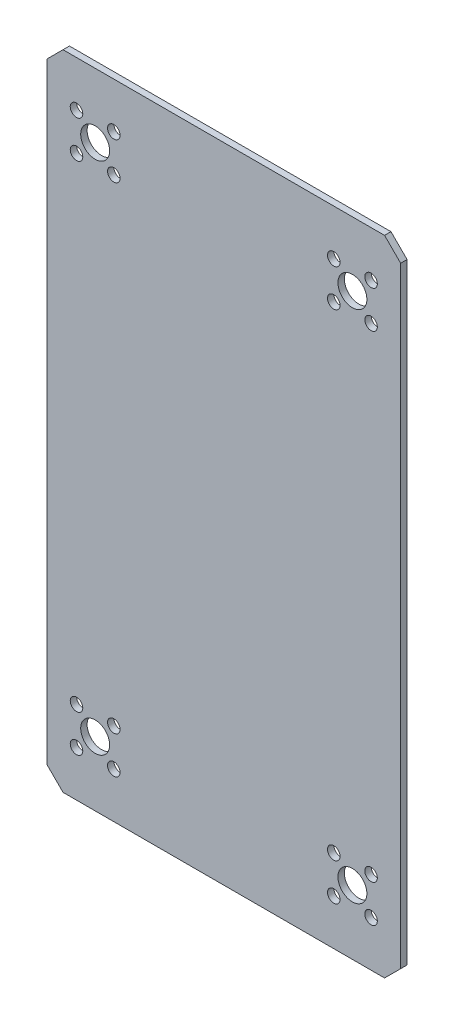
from build123d import *

# Parameters (mm, degrees)
SKETCH1_W           = 110
SKETCH1_H           = 200
BOSS_EXTRUDE1_DEPTH = 2
SKETCH6_R           = 4.5
SKETCH6_R_2         = 1.95
LEANDUT_HOLES_DEPTH = 115.144645078
CHAMFER1_SIZE       = 5


with BuildPart() as part:
    # Sketch1 → Boss-Extrude1 (new body)
    with BuildSketch(Plane.XY):
        Rectangle(SKETCH1_W, SKETCH1_H)
    extrude(amount=BOSS_EXTRUDE1_DEPTH)

    # Sketch6 → Leandut_holes (cut, through all)
    with BuildSketch(Plane.XY.offset(2)):
        with Locations((-40, 80)):
            Circle(SKETCH6_R)
        with Locations((-45.8, 85.8)):
            Circle(SKETCH6_R_2)
        with Locations((-45.8, 74.2)):
            Circle(SKETCH6_R_2)
        with Locations((-34.2, 74.2)):
            Circle(SKETCH6_R_2)
        with Locations((-34.2, 85.8)):
            Circle(SKETCH6_R_2)
        with Locations((34.2, 85.8)):
            Circle(SKETCH6_R_2)
        with Locations((34.2, 74.2)):
            Circle(SKETCH6_R_2)
        with Locations((45.8, 74.2)):
            Circle(SKETCH6_R_2)
        with Locations((45.8, 85.8)):
            Circle(SKETCH6_R_2)
        with Locations((40, 80)):
            Circle(SKETCH6_R)
        with Locations((40, -80)):
            Circle(SKETCH6_R)
        with Locations((45.8, -85.8)):
            Circle(SKETCH6_R_2)
        with Locations((45.8, -74.2)):
            Circle(SKETCH6_R_2)
        with Locations((34.2, -74.2)):
            Circle(SKETCH6_R_2)
        with Locations((34.2, -85.8)):
            Circle(SKETCH6_R_2)
        with Locations((-34.2, -85.8)):
            Circle(SKETCH6_R_2)
        with Locations((-34.2, -74.2)):
            Circle(SKETCH6_R_2)
        with Locations((-45.8, -74.2)):
            Circle(SKETCH6_R_2)
        with Locations((-45.8, -85.8)):
            Circle(SKETCH6_R_2)
        with Locations((-40, -80)):
            Circle(SKETCH6_R)
    extrude(amount=-LEANDUT_HOLES_DEPTH, mode=Mode.SUBTRACT)

    # Chamfer1
    chamfer1_edges = [part.edges().sort_by_distance(p)[0] for p in [
        (-55, -100, 1),
        (55, -100, 1),
        (55, 100, 1),
        (-55, 100, 1),
    ]]
    chamfer(chamfer1_edges, length=CHAMFER1_SIZE)


solid = part.part
